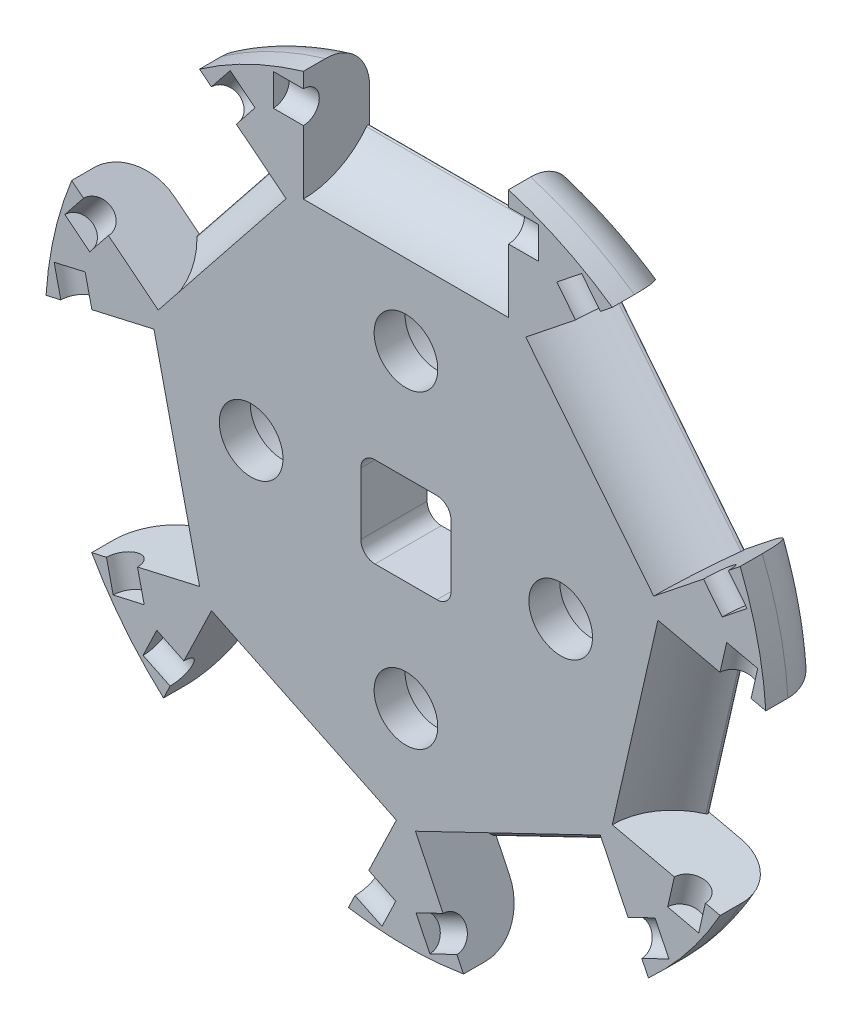
from build123d import *

# Parameters (mm, degrees)
SKETCH1_R                = 25.8953
BOSS_EXTRUDE2_DEPTH      = 4.7625
FILLET1_R                = 3.175
SKETCH2_W                = 14.732
SKETCH2_H                = 10.414
CUT_EXTRUDE2_DEPTH       = 12.7
CIRPATTERN1_COUNT        = 7
SKETCH4_R                = 1.143
CUT_EXTRUDE4_DEPTH       = 9.525
CIRPATTERN2_COUNT        = 7
SKETCH5_W                = 6.477
SKETCH5_H                = 6.477
CUT_EXTRUDE5_DEPTH       = 37.89266219
SKETCH6_R                = 2.286
CUT_EXTRUDE7_DEPTH       = 37.89266219
SKETCH7_R                = 4.445
CUT_EXTRUDE8_DEPTH       = 2.54
BOSS_EXTRUDE4_REACH      = 44.38
FILLET2_R                = 0.127
CIRPATTERN5_COUNT        = 7
FILLET2_OF_CIRPATTERN5_R = 0.127
FILLET3_R                = 1.016


with BuildPart() as part:
    # Sketch1 → Boss-Extrude2 (new body)
    with BuildSketch(Plane.XY):
        Circle(SKETCH1_R)
    extrude(amount=-BOSS_EXTRUDE2_DEPTH)

    # Fillet1
    fillet1_edges = [part.edges().sort_by_distance(p)[0] for p in [
        (-25.8953, 0, -4.7625),
    ]]
    fillet(fillet1_edges, radius=FILLET1_R)

    # Sketch2 → Cut-Extrude2 (cut)
    with BuildSketch(Plane.XY):
        with Locations((0, 21.9583)):
            Rectangle(SKETCH2_W, SKETCH2_H)
    cut_extrude2 = extrude(amount=-CUT_EXTRUDE2_DEPTH, mode=Mode.SUBTRACT)

    # CirPattern1: Cut-Extrude2 ×7 about axis
    cirpattern1_axis = Axis((0, 0, 0), (0, 0, 1))
    for i in range(1, CIRPATTERN1_COUNT):
        add(cut_extrude2.rotate(cirpattern1_axis, i * 360 / CIRPATTERN1_COUNT), mode=Mode.SUBTRACT)

    # Sketch4 → Cut-Extrude4 (cut, symmetric)
    with BuildSketch(Plane(origin=(0, 0, 0), x_dir=(0, 0, -1), z_dir=(1, 0, 0))):
        with Locations((0, 22.5933)):
            Circle(SKETCH4_R)
    cut_extrude4 = extrude(amount=CUT_EXTRUDE4_DEPTH, both=True, mode=Mode.SUBTRACT)

    # CirPattern2: Cut-Extrude4 ×7 about axis
    cirpattern2_axis = Axis((0, 0, 0), (0, 0, 1))
    for i in range(1, CIRPATTERN2_COUNT):
        add(cut_extrude4.rotate(cirpattern2_axis, i * 360 / CIRPATTERN2_COUNT), mode=Mode.SUBTRACT)

    # Sketch5 → Cut-Extrude5 (cut, through all)
    with BuildSketch(Plane.XY):
        Rectangle(SKETCH5_W, SKETCH5_H)
    extrude(amount=-CUT_EXTRUDE5_DEPTH, mode=Mode.SUBTRACT)

    # Sketch6 → Cut-Extrude7 (cut, through all)
    with BuildSketch(Plane(origin=(0, 0, -4.7625), x_dir=(-1, 0, 0), z_dir=(0, 0, -1))):
        with Locations((0, 11.1125)):
            Circle(SKETCH6_R)
        with Locations((11.1125, 0)):
            Circle(SKETCH6_R)
        with Locations((0, -11.1125)):
            Circle(SKETCH6_R)
        with Locations((-11.1125, 0)):
            Circle(SKETCH6_R)
    extrude(amount=-CUT_EXTRUDE7_DEPTH, mode=Mode.SUBTRACT)

    # Sketch7 → Cut-Extrude8 (cut)
    with BuildSketch(Plane(origin=(0, 0, -4.7625), x_dir=(-1, 0, 0), z_dir=(0, 0, -1))):
        with Locations((-11.1125, 0)):
            Circle(SKETCH7_R)
        with Locations((11.1125, 0)):
            Circle(SKETCH7_R)
        with Locations((0, -11.1125)):
            Circle(SKETCH7_R)
        with Locations((0, 11.1125)):
            Circle(SKETCH7_R)
    extrude(amount=-CUT_EXTRUDE8_DEPTH, mode=Mode.SUBTRACT)

    # Sketch10 → Boss-Extrude4 (add, up to next)
    with BuildSketch(Plane.ZY.offset(-7.366), mode=Mode.PRIVATE) as boss_extrude4_sk1:
        with BuildLine():
            Line((-4.7625, 16.7513), (0, 16.7513))
            Line((0, 16.7513), (0, 16.8783))
            ThreePointArc((0, 16.8783), (-2.7025038, 17.55765722), (-4.7625, 19.434214887))
            Line((-4.7625, 19.434214887), (-4.7625, 16.7513))
        make_face()
    boss_extrude4_tool1 = extrude(boss_extrude4_sk1.sketch, amount=BOSS_EXTRUDE4_REACH, mode=Mode.PRIVATE) - part.part
    boss_extrude4 = boss_extrude4_tool1.solids().sort_by_distance((7.366, 17.489807, -3.452063))[0]
    add(boss_extrude4)

    # Fillet2
    fillet2_edges = [part.edges().sort_by_distance(p)[0] for p in [
        (0, 19.434214887, -4.7625),
    ]]
    fillet(fillet2_edges, radius=FILLET2_R)

    # CirPattern5: Boss-Extrude4 ×7 about axis
    cirpattern5_axis = Axis((0, 0, 0), (0, 0, 1))
    for i in range(1, CIRPATTERN5_COUNT):
        add(boss_extrude4.rotate(cirpattern5_axis, i * 360 / CIRPATTERN5_COUNT))

    # Fillet2 of CirPattern5
    fillet2_of_cirpattern5_edges = [part.edges().sort_by_distance(p)[0] for p in [
        (-15.194281036, 12.117034789, -4.7625),
        (-18.946958545, -4.324519647, -4.7625),
        (-8.432189822, -17.509622585, -4.7625),
        (8.432189822, -17.509622585, -4.7625),
        (18.946958545, -4.324519647, -4.7625),
        (15.194281036, 12.117034789, -4.7625),
    ]]
    fillet(fillet2_of_cirpattern5_edges, radius=FILLET2_OF_CIRPATTERN5_R)

    # Fillet3
    fillet3_edges = [part.edges().sort_by_distance(p)[0] for p in [
        (3.2385, 3.2385, -2.38125),
        (3.2385, -3.2385, -2.38125),
        (-3.2385, -3.2385, -2.38125),
        (-3.2385, 3.2385, -2.38125),
    ]]
    fillet(fillet3_edges, radius=FILLET3_R)


solid = part.part
